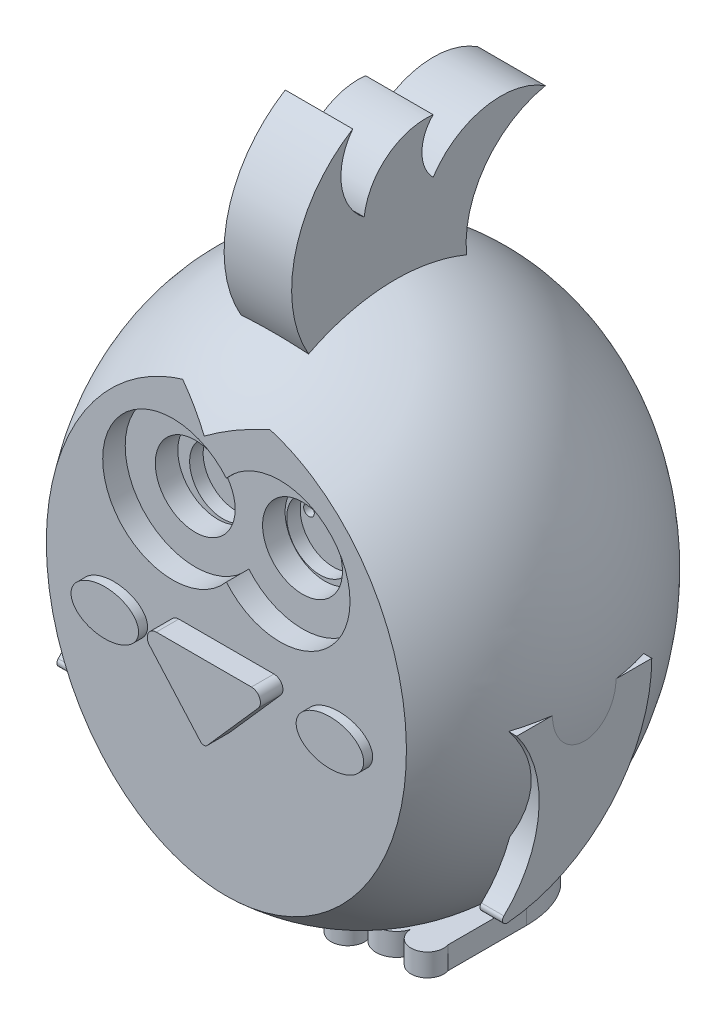
from build123d import *

# Parameters (mm, degrees)
CUT_EXTRUDE2_DEPTH    = 20
SKETCH2_7_R           = 8.872646325
CUT_EXTRUDE3_DEPTH    = 25
SKETCH2_9_R           = 8.872646325
SKETCH2_9_R_2         = 1.18870597
CUT_EXTRUDE5_DEPTH    = 30
SKETCH2_10_R          = 7.373380305
SKETCH2_10_R_2        = 1.18870597
CUT_EXTRUDE6_DEPTH    = 33
SKETCH2_11_R          = 1.18870597
CUT_EXTRUDE7_DEPTH    = 35
BOSS_EXTRUDE2_DEPTH   = 25
BOSS_EXTRUDE6_DEPTH   = 2.5
BOSS_EXTRUDE6_2_DEPTH = 2.5
BOSS_EXTRUDE7_DEPTH   = 2.5
SKETCH9_RX            = 7.5
SKETCH9_RY            = 5
BOSS_EXTRUDE8_DEPTH   = 5
BOSS_EXTRUDE10_DEPTH  = 7.5


with BuildPart() as part:
    # Sketch1 → Revolve2 (revolve)
    with BuildSketch(Plane.XY):
        with BuildLine():
            Line((0, 60), (0, -60))
            add(Edge.make_bspline(
                [(0, -60), (50, -60), (50, 0), (50, 60), (0, 60)],
                knots=[3.141592654, 3.141592654, 3.141592654, 4.71238898, 4.71238898, 6.283185307, 6.283185307, 6.283185307], degree=2, weights=[1, 0.707106781, 1, 0.707106781, 1]))
        make_face()
    revolve(axis=Axis((0, 60, 0), (0, -1, 0)))

    # Sketch2 → Cut-Extrude2 (cut)
    with BuildSketch(Plane.XY.offset(50)):
        with BuildLine():
            ThreePointArc((41.285150398, 22.386728109), (36.472341891, -24.380143938), (0, -54.046146765))
            ThreePointArc((0, -54.046146765), (-36.472341891, -24.380143938), (-41.285150398, 22.386728109))
            ThreePointArc((-41.285150398, 22.386728109), (-26.324565687, 44.076185905), (0, 42.949724298))
            ThreePointArc((0, 42.949724298), (26.324565687, 44.076185905), (41.285150398, 22.386728109))
        make_face()
    extrude(amount=-CUT_EXTRUDE2_DEPTH, mode=Mode.SUBTRACT)

    # Sketch2<7> → Cut-Extrude3 (cut)
    with BuildSketch(Plane.XY.offset(50)):
        with BuildLine():
            ThreePointArc((0, 12.40691032), (27.467430803, 22.386728109), (0, 32.366545898))
            ThreePointArc((0, 32.366545898), (-27.467430803, 22.386728109), (0, 12.40691032))
        make_face()
        with Locations((11.920717968, 22.386728109)):
            Circle(SKETCH2_7_R, mode=Mode.SUBTRACT)
        with Locations((-11.920717968, 22.386728109)):
            Circle(SKETCH2_7_R, mode=Mode.SUBTRACT)
    extrude(amount=-CUT_EXTRUDE3_DEPTH, mode=Mode.SUBTRACT)

    # Sketch2<9> → Cut-Extrude5 (cut)
    # profile 1 of 2: a face of its own
    with BuildSketch(Plane.XY.offset(50)):
        with Locations((11.920717968, 22.386728109)):
            Circle(SKETCH2_9_R)
        with BuildLine():
            ThreePointArc((10.779480977, 28.18499349), (14.07809427, 27.683436636), (16.055911846, 24.996310555))
            ThreePointArc((16.055911846, 24.996310555), (15.572778068, 24.796189992), (15.08964429, 24.996310555))
            ThreePointArc((15.08964429, 24.996310555), (13.354815816, 26.903555539), (10.779480977, 27.025472423))
            ThreePointArc((10.779480977, 27.025472423), (10.199720443, 27.605232956), (10.779480977, 28.18499349))
        make_face(mode=Mode.SUBTRACT)
        with Locations((5.344292857, 22.386728109)):
            Circle(SKETCH2_9_R_2, mode=Mode.SUBTRACT)
    # profile 2 of 2: a face of its own
    with BuildSketch(Plane.XY.offset(50)):
        with Locations((-11.920717968, 22.386728109)):
            Circle(SKETCH2_9_R)
        with BuildLine():
            ThreePointArc((-16.055911846, 24.996310555), (-14.07809427, 27.683436636), (-10.779480977, 28.18499349))
            ThreePointArc((-10.779480977, 28.18499349), (-10.199720443, 27.605232956), (-10.779480977, 27.025472423))
            ThreePointArc((-10.779480977, 27.025472423), (-13.354815816, 26.903555539), (-15.08964429, 24.996310555))
            ThreePointArc((-15.08964429, 24.996310555), (-15.572778068, 24.796189992), (-16.055911846, 24.996310555))
        make_face(mode=Mode.SUBTRACT)
        with Locations((-5.344292857, 22.386728109)):
            Circle(SKETCH2_9_R_2, mode=Mode.SUBTRACT)
    extrude(amount=-CUT_EXTRUDE5_DEPTH, mode=Mode.SUBTRACT)

    # Sketch2<10> → Cut-Extrude6 (cut)
    # profile 1 of 2: a face of its own
    with BuildSketch(Plane.XY.offset(50)):
        with Locations((10.779480977, 21.546137015)):
            Circle(SKETCH2_10_R)
        with Locations((5.344292857, 22.386728109)):
            Circle(SKETCH2_10_R_2, mode=Mode.SUBTRACT)
        with BuildLine():
            ThreePointArc((10.779480977, 27.025472423), (10.199720443, 27.605232956), (10.779480977, 28.18499349))
            ThreePointArc((10.779480977, 28.18499349), (14.07809427, 27.683436636), (16.055911846, 24.996310555))
            ThreePointArc((16.055911846, 24.996310555), (15.572778068, 24.796189992), (15.08964429, 24.996310555))
            ThreePointArc((15.08964429, 24.996310555), (13.354815816, 26.903555539), (10.779480977, 27.025472423))
        make_face(mode=Mode.SUBTRACT)
    # profile 2 of 2: a face of its own
    with BuildSketch(Plane.XY.offset(50)):
        with Locations((-10.779480977, 21.546137015)):
            Circle(SKETCH2_10_R)
        with BuildLine():
            ThreePointArc((-16.055911846, 24.996310555), (-14.07809427, 27.683436636), (-10.779480977, 28.18499349))
            ThreePointArc((-10.779480977, 28.18499349), (-10.199720443, 27.605232956), (-10.779480977, 27.025472423))
            ThreePointArc((-10.779480977, 27.025472423), (-13.354815816, 26.903555539), (-15.08964429, 24.996310555))
            ThreePointArc((-15.08964429, 24.996310555), (-15.572778068, 24.796189992), (-16.055911846, 24.996310555))
        make_face(mode=Mode.SUBTRACT)
        with Locations((-5.344292857, 22.386728109)):
            Circle(SKETCH2_10_R_2, mode=Mode.SUBTRACT)
    extrude(amount=-CUT_EXTRUDE6_DEPTH, mode=Mode.SUBTRACT)

    # Sketch2<11> → Cut-Extrude7 (cut)
    with BuildSketch(Plane.XY.offset(50)):
        with Locations((5.344292857, 22.386728109)):
            Circle(SKETCH2_11_R)
        with Locations((-5.344292857, 22.386728109)):
            Circle(SKETCH2_11_R)
        with BuildLine():
            ThreePointArc((10.779480977, 28.18499349), (14.07809427, 27.683436636), (16.055911846, 24.996310555))
            ThreePointArc((16.055911846, 24.996310555), (15.572778068, 24.796189992), (15.08964429, 24.996310555))
            ThreePointArc((15.08964429, 24.996310555), (13.354815816, 26.903555539), (10.779480977, 27.025472423))
            ThreePointArc((10.779480977, 27.025472423), (10.199720443, 27.605232956), (10.779480977, 28.18499349))
        make_face()
        with BuildLine():
            ThreePointArc((-10.779480977, 28.18499349), (-10.199720443, 27.605232956), (-10.779480977, 27.025472423))
            ThreePointArc((-10.779480977, 27.025472423), (-13.354815816, 26.903555539), (-15.08964429, 24.996310555))
            ThreePointArc((-15.08964429, 24.996310555), (-15.572778068, 24.796189992), (-16.055911846, 24.996310555))
            ThreePointArc((-16.055911846, 24.996310555), (-14.07809427, 27.683436636), (-10.779480977, 28.18499349))
        make_face()
    extrude(amount=-CUT_EXTRUDE7_DEPTH, mode=Mode.SUBTRACT)

    # Sketch6 → Boss-Extrude2 (add)
    with BuildSketch(Plane.XY.offset(10)):
        with BuildLine():
            Line((-10.568050812, 0), (10.568050812, 0))
            ThreePointArc((10.568050812, 0), (12.3910273, -1.177347749), (12.067726523, -3.323243274))
            Line((12.067726523, -3.323243274), (0.749837855, -16.150183764))
            ThreePointArc((0.749837855, -16.150183764), (0, -16.488562127), (-0.749837855, -16.150183764))
            Line((-0.749837855, -16.150183764), (-12.067726523, -3.323243274))
            ThreePointArc((-12.067726523, -3.323243274), (-12.3910273, -1.177347749), (-10.568050812, 0))
        make_face()
    extrude(amount=BOSS_EXTRUDE2_DEPTH)

    # Sketch8 → Boss-Extrude7 (add, symmetric)
    with BuildSketch(Plane(origin=(47, 0, 0), x_dir=(0, 0, -1), z_dir=(1, 0, 0))):
        with BuildLine():
            Line((15, 0), (-15, 0))
            ThreePointArc((-15, 0), (-10.105542078, -17.119336759), (-17.845724339, -33.154204641))
            ThreePointArc((-17.845724339, -33.154204641), (-18.071954176, -34.289168918), (-17.075436081, -34.877620732))
            ThreePointArc((-17.075436081, -34.877620732), (5.761992239, -23.692209189), (15, 0))
        make_face()
    boss_extrude7 = extrude(amount=BOSS_EXTRUDE7_DEPTH, both=True)

    # Mirror2: Boss-Extrude7 across plane
    add(boss_extrude7.mirror(Plane(origin=(0, 0, 0), x_dir=(0, 0, 1), z_dir=(1, 0, 0))))

    # Sketch9 → Boss-Extrude8 (add)
    with BuildSketch(Plane.XY.offset(27)):
        with Locations(Location((25, -5), (0, 0, 0))):
            Ellipse(SKETCH9_RX, SKETCH9_RY)
        with Locations(Location((-25, -5), (0, 0, 180))):
            Ellipse(SKETCH9_RX, SKETCH9_RY)
    extrude(amount=BOSS_EXTRUDE8_DEPTH)

    # Sketch10 → Boss-Extrude10 (add, symmetric)
    with BuildSketch(Plane(origin=(0, 0, 0), x_dir=(0, 0, -1), z_dir=(1, 0, 0))):
        with BuildLine():
            Line((16.20528313, 53.884869871), (-18.79471687, 53.884869871))
            ThreePointArc((-18.79471687, 53.884869871), (-22.217421332, 75.398682284), (-9.425076221, 93.031462466))
            ThreePointArc((-9.425076221, 93.031462466), (-11.92989731, 83.395693485), (-6.8875557, 74.810999918))
            ThreePointArc((-6.8875557, 74.810999918), (-1.722839358, 84.00163855), (8.427929491, 86.848395502))
            ThreePointArc((8.427929491, 86.848395502), (5.934903237, 80.82969771), (8.427929491, 74.810999918))
            ThreePointArc((8.427929491, 74.810999918), (19.822532836, 82.547505522), (33.350269705, 79.960839802))
            ThreePointArc((33.350269705, 79.960839802), (19.377266219, 70.47369782), (16.20528313, 53.884869871))
        make_face()
    extrude(amount=BOSS_EXTRUDE10_DEPTH, both=True)


with BuildPart() as body_2:
    # Sketch7 → Boss-Extrude6 (new, symmetric)
    with BuildSketch(Plane(origin=(0, -60, 0), x_dir=(-1, 0, 0), z_dir=(0, -1, 0))):
        with BuildLine():
            Line((24.493670886, 12.163597182), (24.493670886, -5.212970221))
            ThreePointArc((24.493670886, -5.212970221), (21.651863027, -9.944680368), (17.36538231, -6.467463681))
            ThreePointArc((17.36538231, -6.467463681), (13.983557077, -9.628048726), (9.595672946, -8.154104155))
            ThreePointArc((9.595672946, -8.154104155), (3.75217878, -11.965408291), (5.506329114, -5.212970221))
            Line((5.506329114, -5.212970221), (5.506329114, 12.163597182))
            add(Edge.make_bspline(
                [(24.493670886, 12.163597182), (24.493670886, 26.404103511), (15, 26.404103511), (5.506329114, 26.404103511), (5.506329114, 12.163597182)],
                knots=[4.71238898, 4.71238898, 4.71238898, 6.283185307, 6.283185307, 7.853981634, 7.853981634, 7.853981634], degree=2, weights=[1, 0.707106781, 1, 0.707106781, 1]))
        make_face()
    extrude(amount=BOSS_EXTRUDE6_DEPTH, both=True)


with BuildPart() as body_3:
    # Sketch7 → Boss-Extrude6 2 (new, symmetric)
    with BuildSketch(Plane(origin=(0, -60, 0), x_dir=(-1, 0, 0), z_dir=(0, -1, 0))):
        with BuildLine():
            Line((-5.506329114, 12.163597182), (-5.506329114, -5.212970221))
            ThreePointArc((-5.506329114, -5.212970221), (-3.75217878, -11.965408291), (-9.595672946, -8.154104155))
            ThreePointArc((-9.595672946, -8.154104155), (-13.983557077, -9.628048726), (-17.36538231, -6.467463681))
            ThreePointArc((-17.36538231, -6.467463681), (-21.651863027, -9.944680368), (-24.493670886, -5.212970221))
            Line((-24.493670886, -5.212970221), (-24.493670886, 12.163597182))
            add(Edge.make_bspline(
                [(-5.506329114, 12.163597182), (-5.506329114, 26.404103511), (-15, 26.404103511), (-24.493670886, 26.404103511), (-24.493670886, 12.163597182)],
                knots=[1.570796327, 1.570796327, 1.570796327, 3.141592654, 3.141592654, 4.71238898, 4.71238898, 4.71238898], degree=2, weights=[1, 0.707106781, 1, 0.707106781, 1]))
        make_face()
    extrude(amount=BOSS_EXTRUDE6_2_DEPTH, both=True)


solid = Compound([part.part, body_2.part, body_3.part])
